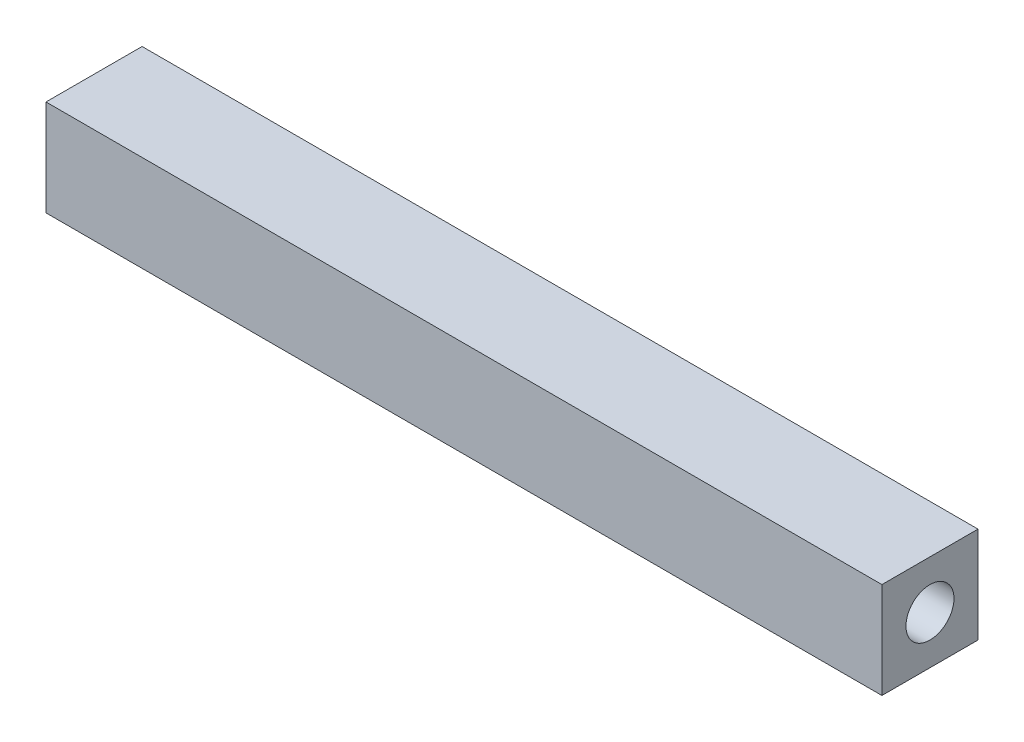
from build123d import *

# Parameters (mm, degrees)
SKETCH1_W           = 87
SKETCH1_H           = 10
BOSS_EXTRUDE1_DEPTH = 10
SKETCH2_R           = 2.5
CUT_EXTRUDE1_DEPTH  = 4


with BuildPart() as part:
    # Sketch1 → Boss-Extrude1 (new body)
    with BuildSketch(Plane(origin=(0, 0, 0), x_dir=(1, 0, 0), z_dir=(0, 1, 0))):
        Rectangle(SKETCH1_W, SKETCH1_H)
    extrude(amount=BOSS_EXTRUDE1_DEPTH)

    # Sketch2 → Cut-Extrude1 (cut)
    with BuildSketch(Plane(origin=(43.5, 0, 0), x_dir=(0, 0, -1), z_dir=(1, 0, 0))):
        with Locations((0, 5)):
            Circle(SKETCH2_R)
    cut_extrude1 = extrude(amount=-CUT_EXTRUDE1_DEPTH, mode=Mode.SUBTRACT)

    # Mirror1: Cut-Extrude1 across plane
    add(cut_extrude1.mirror(Plane(origin=(0, 0, 0), x_dir=(0, 0, 1), z_dir=(1, 0, 0))), mode=Mode.SUBTRACT)


solid = part.part
